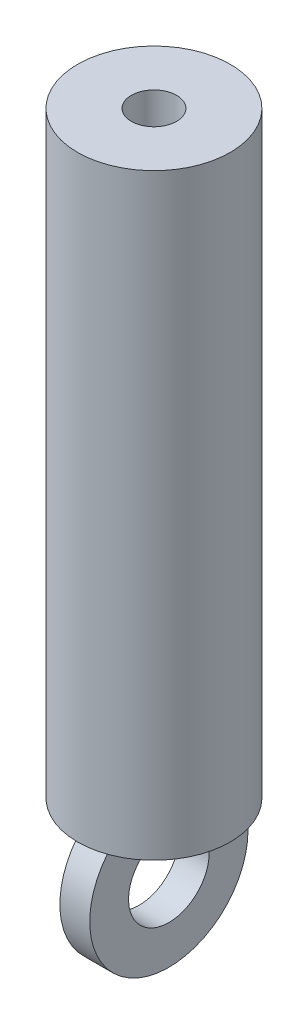
from build123d import *

# Parameters (mm, degrees)
EXTRUDE1_START = 1.27
SKETCH1_R      = 4.5466
SKETCH1_R_2    = 1.3462
EXTRUDE1_DEPTH = 35.56
SKETCH4_R      = 4.7117
SKETCH4_R_2    = 2.4003
EXTRUDE2_DEPTH = 0.889


with BuildPart() as part:
    # Sketch1 → Extrude1 (new body)
    with BuildSketch(Plane(origin=(0, 0, 0), x_dir=(1, 0, 0), z_dir=(0, 1, 0)).offset(EXTRUDE1_START)):
        with Locations(Location((0, 0, 0), (0, 0, 270))):
            Circle(SKETCH1_R)
        with Locations(Location((0, 0, 0), (0, 0, 270))):
            Circle(SKETCH1_R_2, mode=Mode.SUBTRACT)
    extrude(amount=EXTRUDE1_DEPTH)


with BuildPart() as body_2:
    # Sketch4 → Extrude2 (new, symmetric)
    with BuildSketch(Plane(origin=(0, 0, 0), x_dir=(0, 0, -1), z_dir=(1, 0, 0))):
        with Locations((0, -2.3114)):
            Circle(SKETCH4_R)
        with Locations((0, -2.3114)):
            Circle(SKETCH4_R_2, mode=Mode.SUBTRACT)
    extrude(amount=EXTRUDE2_DEPTH, both=True)


solid = Compound([part.part, body_2.part])
